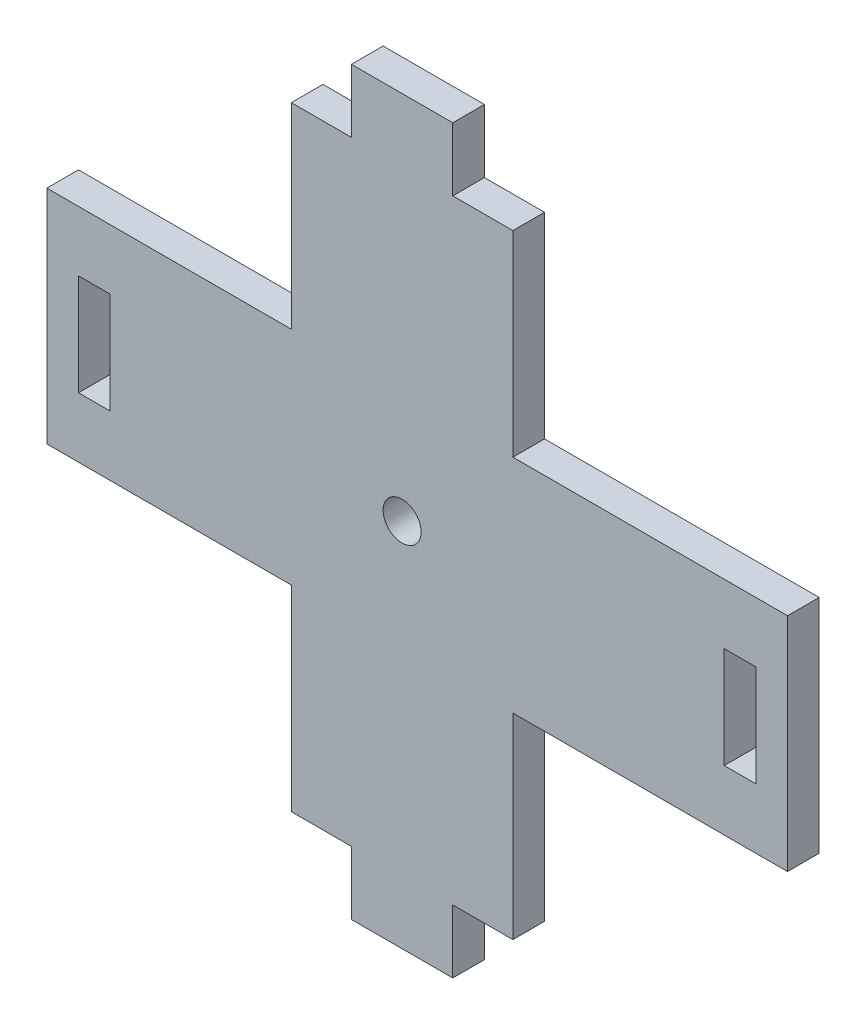
from build123d import *

# Parameters (mm, degrees)
BOSS_EXTRUDE3_DEPTH = 5
SKETCH2_W           = 5
SKETCH2_H           = 16
CUT_EXTRUDE1_DEPTH  = 140.606590102
SKETCH3_R           = 3
CUT_EXTRUDE2_DEPTH  = 140.606590102


with BuildPart() as part:
    # Sketch1 → Boss-Extrude3 (new body)
    with BuildSketch(Plane.XY):
        Polygon((0, 0), (38.61949762, 0), (38.61949762, -31), (48.11949762, -31), (48.11949762, -41), (64.11949762, -41), (64.11949762, -31), (73.61949762, -31), (73.61949762, 0), (117, 0), (117, 35), (73.61949762, 35), (73.61949762, 66), (64.11949762, 66), (64.11949762, 76), (48.11949762, 76), (48.11949762, 66), (38.61949762, 66), (38.61949762, 35), (0, 35), align=None)
    extrude(amount=BOSS_EXTRUDE3_DEPTH)

    # Sketch2 → Cut-Extrude1 (cut, through all)
    with BuildSketch(Plane.XY.offset(5)):
        with Locations((7.5, 17.5)):
            Rectangle(SKETCH2_W, SKETCH2_H)
        with Locations((109.5, 17.5)):
            Rectangle(SKETCH2_W, SKETCH2_H)
    extrude(amount=-CUT_EXTRUDE1_DEPTH, mode=Mode.SUBTRACT)

    # Sketch3 → Cut-Extrude2 (cut, through all)
    with BuildSketch(Plane.XY.offset(5)):
        with Locations((56.11949762, 17.5)):
            Circle(SKETCH3_R)
    extrude(amount=-CUT_EXTRUDE2_DEPTH, mode=Mode.SUBTRACT)


solid = part.part
